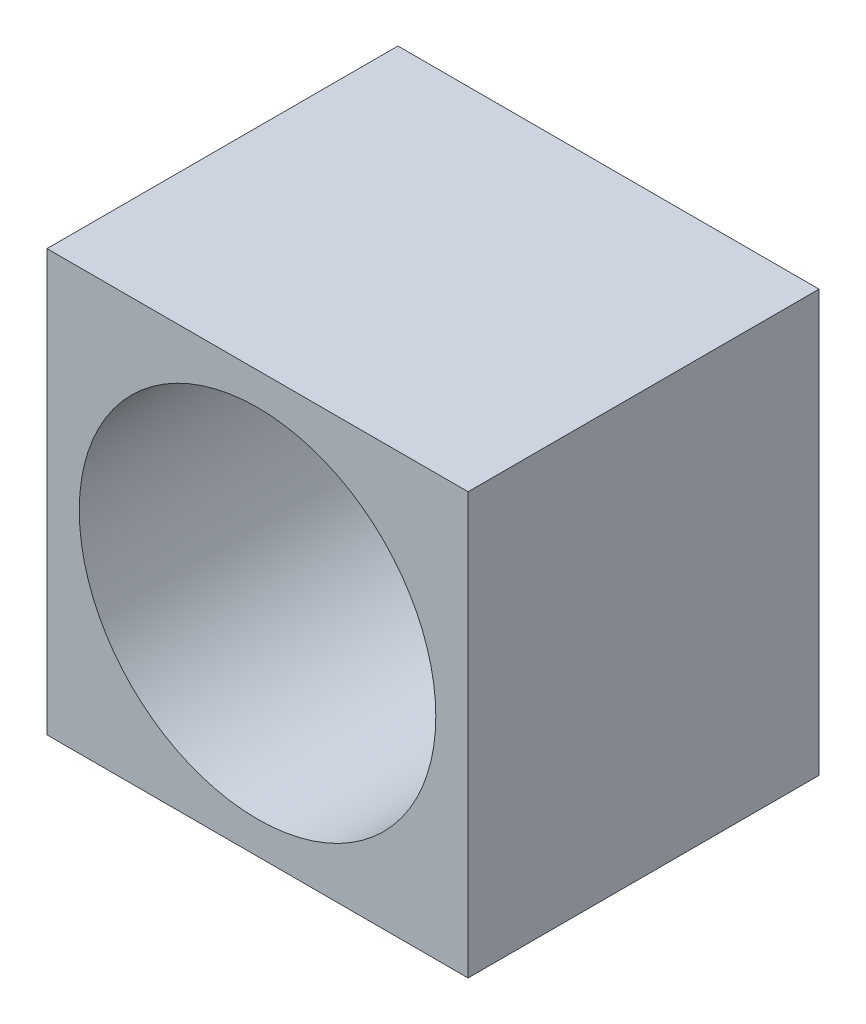
from build123d import *

# Parameters (mm, degrees)
BOSS_EXTRUDE1_DEPTH      = 15
BOSS_EXTRUDE1_DEPTH_BACK = 15
SKETCH1_W                = 30
SKETCH1_H                = 25
SKETCH2_R                = 12.7
CUT_EXTRUDE1_DEPTH       = 33.787192622


with BuildPart() as part:
    # Sketch1 → Boss-Extrude1 (new, two sides: drawn at the far end of the back side and taken through both)
    with BuildSketch(Plane(origin=(0, 0, 0), x_dir=(1, 0, 0), z_dir=(0, 1, 0)).offset(-BOSS_EXTRUDE1_DEPTH_BACK)):
        Rectangle(SKETCH1_W, SKETCH1_H)
    extrude(amount=BOSS_EXTRUDE1_DEPTH + BOSS_EXTRUDE1_DEPTH_BACK)

    # Sketch2 → Cut-Extrude1 (cut, through all)
    with BuildSketch(Plane.XY.offset(12.5)):
        Circle(SKETCH2_R)
    extrude(amount=-CUT_EXTRUDE1_DEPTH, mode=Mode.SUBTRACT)


solid = part.part
